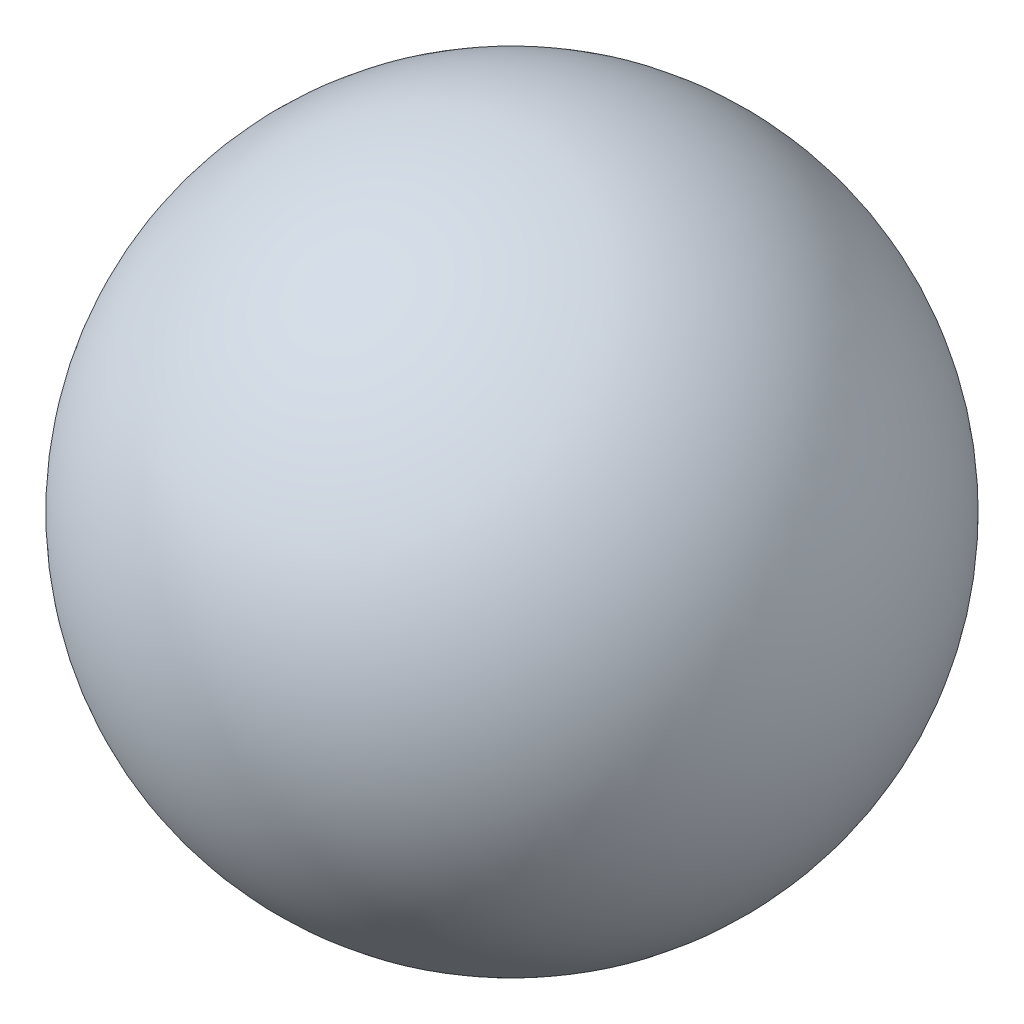
from build123d import *


with BuildPart() as part:
    # Sketch1 → Revolve1 (revolve)
    with BuildSketch(Plane.XY):
        with BuildLine():
            Line((0, 0), (0, 12.5))
            ThreePointArc((0, 12.5), (-12.5, 0), (0, -12.5))
            Line((0, -12.5), (0, 0))
        make_face()
    revolve(axis=Axis((0, 0, 0), (0, 1, 0)))


solid = part.part
